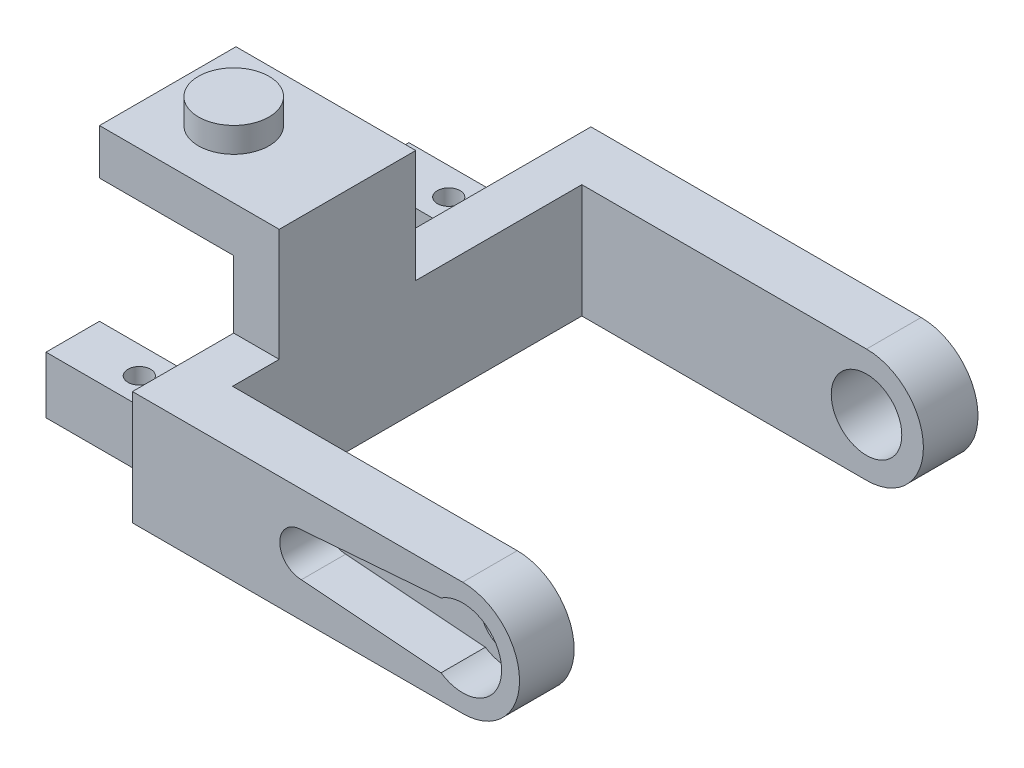
from build123d import *

# Parameters (mm, degrees)
BOSS_EXTRUDE1_DEPTH     = 20.15
CUT_EXTRUDE1_DEPTH      = 40.134529676
CUT_EXTRUDE1_DEPTH_BACK = 40.134529676
CUT_EXTRUDE2_DEPTH      = 3.9
SKETCH5_R               = 2.3
CUT_EXTRUDE6_DEPTH      = 39.164268799
SKETCH6_R               = 3.1
CUT_EXTRUDE7_DEPTH      = 39.164268799
SKETCH7_W               = 11.8
SKETCH7_H               = 4.7
SKETCH7_R               = 1
BOSS_EXTRUDE2_DEPTH     = 5
SKETCH8_W               = 4
SKETCH8_H               = 12
BOSS_EXTRUDE3_DEPTH     = 9.9
SKETCH9_W               = 11.8
SKETCH9_H               = 12
BOSS_EXTRUDE4_DEPTH     = 4
SKETCH10_R              = 3.1
BOSS_EXTRUDE5_DEPTH     = 2.2


with BuildPart() as part:
    # Sketch1 → Boss-Extrude1 (new, symmetric)
    with BuildSketch(Plane.XY):
        with BuildLine():
            Line((-27.023255814, 5), (27.023255814, 5))
            ThreePointArc((27.023255814, 5), (32.023255814, 0), (27.023255814, -5))
            Line((27.023255814, -5), (-27.023255814, -5))
            ThreePointArc((-27.023255814, -5), (-32.023255814, 0), (-27.023255814, 5))
        make_face()
    extrude(amount=BOSS_EXTRUDE1_DEPTH, both=True)

    # Sketch2 → Cut-Extrude1 (cut, two sides: drawn at the far end of the back side and taken through both)
    with BuildSketch(Plane(origin=(0, 5, 0), x_dir=(1, 0, 0), z_dir=(0, 1, 0)).offset(-CUT_EXTRUDE1_DEPTH_BACK)):
        Polygon((-2, -20.15), (-2, 20.15), (-27.023255814, 20.15), (-37.952019542, 20.15), (-37.952019542, -20.15), (-27.023255814, -20.15), align=None)
        Polygon((27.023255814, 15.35), (38.05829872, 15.35), (38.05829872, -15.35), (27.023255814, -15.35), (2, -15.35), (2, 15.35), align=None)
    extrude(amount=CUT_EXTRUDE1_DEPTH + CUT_EXTRUDE1_DEPTH_BACK, mode=Mode.SUBTRACT)

    # Sketch4 → Cut-Extrude2 (cut)
    with BuildSketch(Plane.XY.offset(20.15)):
        with BuildLine():
            Line((25.123749299, 2.85), (12.848255814, 1.9))
            ThreePointArc((12.848255814, 1.9), (10.948255814, 0), (12.848255814, -1.9))
            Line((12.848255814, -1.9), (25.123749299, -2.85))
            ThreePointArc((25.123749299, -2.85), (30.448255814, 0), (25.123749299, 2.85))
        make_face()
    extrude(amount=-CUT_EXTRUDE2_DEPTH, mode=Mode.SUBTRACT)

    # Sketch5 → Cut-Extrude6 (cut, through all)
    with BuildSketch(Plane.XY):
        with Locations((27.023255814, 0)):
            Circle(SKETCH5_R)
    extrude(amount=CUT_EXTRUDE6_DEPTH, mode=Mode.SUBTRACT)

    # Sketch6 → Cut-Extrude7 (cut, through all)
    with BuildSketch(Plane.XY):
        with Locations((27.023255814, 0)):
            Circle(SKETCH6_R)
    extrude(amount=-CUT_EXTRUDE7_DEPTH, mode=Mode.SUBTRACT)

    # Sketch7 → Boss-Extrude2 (add)
    # profile 1 of 2: a face of its own
    with BuildSketch(Plane(origin=(0, 0, 0), x_dir=(1, 0, 0), z_dir=(0, 1, 0))):
        with Locations((-7.9, 13.6)):
            Rectangle(SKETCH7_W, SKETCH7_H)
        with Locations(Location((-7.9, 13.55, 0), (0, 0, 270))):
            Circle(SKETCH7_R, mode=Mode.SUBTRACT)
    # profile 2 of 2: a face of its own
    with BuildSketch(Plane(origin=(0, 0, 0), x_dir=(1, 0, 0), z_dir=(0, 1, 0))):
        with Locations((-7.9, -13.6)):
            Rectangle(SKETCH7_W, SKETCH7_H)
        with Locations(Location((-7.9, -13.65, 0), (0, 0, 270))):
            Circle(SKETCH7_R, mode=Mode.SUBTRACT)
    extrude(amount=-BOSS_EXTRUDE2_DEPTH)

    # Sketch8 → Boss-Extrude3 (add)
    with BuildSketch(Plane(origin=(0, 5, 0), x_dir=(1, 0, 0), z_dir=(0, 1, 0))):
        with Locations((0, -5.25)):
            Rectangle(SKETCH8_W, SKETCH8_H)
    extrude(amount=BOSS_EXTRUDE3_DEPTH)

    # Sketch9 → Boss-Extrude4 (add)
    with BuildSketch(Plane(origin=(0, 14.9, 0), x_dir=(1, 0, 0), z_dir=(0, 1, 0))):
        with Locations((-7.9, -5.25)):
            Rectangle(SKETCH9_W, SKETCH9_H)
    extrude(amount=-BOSS_EXTRUDE4_DEPTH)

    # Sketch10 → Boss-Extrude5 (add)
    with BuildSketch(Plane(origin=(0, 14.9, 0), x_dir=(1, 0, 0), z_dir=(0, 1, 0))):
        with Locations(Location((-7.899152482, -5.35, 0), (0, 0, 270))):
            Circle(SKETCH10_R)
    extrude(amount=BOSS_EXTRUDE5_DEPTH)


solid = part.part
